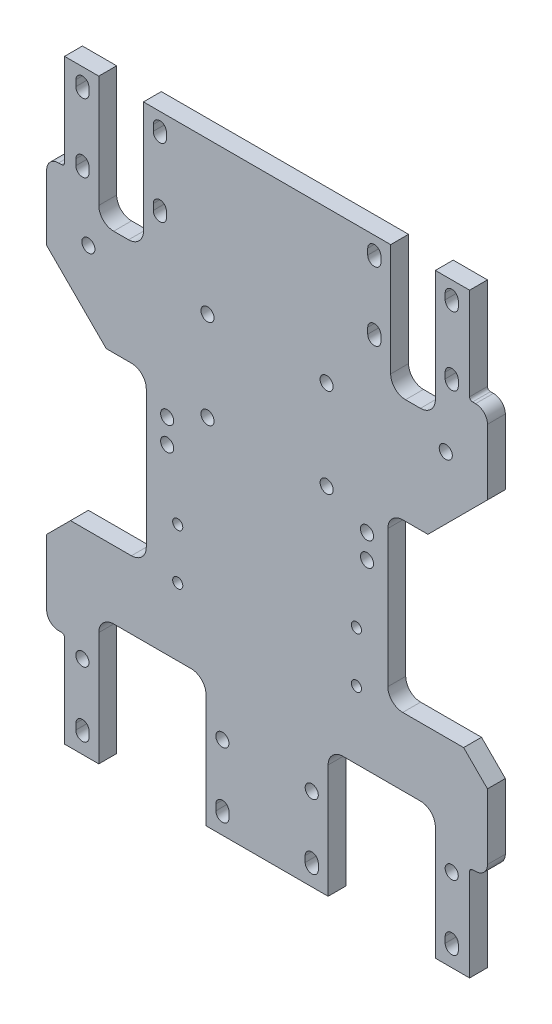
from build123d import *

# Parameters (mm, degrees)
SKETCH1_R           = 2.2
SKETCH1_R_2         = 1.7
BOSS_EXTRUDE1_DEPTH = 6


with BuildPart() as part:
    # Sketch1 → Boss-Extrude1 (new body)
    with BuildSketch(Plane.XY.offset(3)):
        with BuildLine():
            Line((40.555136163, -29), (40.555136163, 17))
            ThreePointArc((40.555136163, 17), (42.019602257, 20.535533906), (45.555136163, 22))
            Line((45.555136163, 22), (54, 22))
            Line((54, 22), (74, 42))
            Line((74, 42), (74, 64))
            ThreePointArc((74, 64), (72.828427125, 66.828427125), (70, 68))
            Line((70, 68), (69, 68))
            ThreePointArc((69, 68), (68.292893219, 68.292893219), (68, 69))
            Line((68, 69), (68, 100))
            Line((68, 100), (56.5, 100))
            Line((56.5, 100), (56.5, 62.4))
            ThreePointArc((56.5, 62.4), (55.035533906, 58.864466094), (51.5, 57.4))
            Line((51.5, 57.4), (46.5, 57.4))
            ThreePointArc((46.5, 57.4), (42.964466094, 58.864466094), (41.5, 62.4))
            Line((41.5, 62.4), (41.5, 100))
            Line((41.5, 100), (-41.5, 100))
            Line((-41.5, 100), (-41.5, 62.4))
            ThreePointArc((-41.5, 62.4), (-42.964466094, 58.864466094), (-46.5, 57.4))
            Line((-46.5, 57.4), (-51.5, 57.4))
            ThreePointArc((-51.5, 57.4), (-55.035533906, 58.864466094), (-56.5, 62.4))
            Line((-56.5, 62.4), (-56.5, 100))
            Line((-56.5, 100), (-68, 100))
            Line((-68, 100), (-68, 69))
            ThreePointArc((-68, 69), (-68.292893219, 68.292893219), (-69, 68))
            Line((-69, 68), (-70, 68))
            ThreePointArc((-70, 68), (-72.828427125, 66.828427125), (-74, 64))
            Line((-74, 64), (-74, 42))
            Line((-74, 42), (-54, 22))
            Line((-54, 22), (-45.555136163, 22))
            ThreePointArc((-45.555136163, 22), (-42.019602257, 20.535533906), (-40.555136163, 17))
            Line((-40.555136163, 17), (-40.555136163, -29))
            ThreePointArc((-40.555136163, -29), (-42.019602257, -32.535533906), (-45.555136163, -34))
            Line((-45.555136163, -34), (-66, -34))
            Line((-66, -34), (-74, -42))
            Line((-74, -42), (-74, -64))
            ThreePointArc((-74, -64), (-72.828427125, -66.828427125), (-70, -68))
            Line((-70, -68), (-69, -68))
            ThreePointArc((-69, -68), (-68.292893219, -68.292893219), (-68, -69))
            Line((-68, -69), (-68, -100))
            Line((-68, -100), (-56.5, -100))
            Line((-56.5, -100), (-56.5, -61.8))
            ThreePointArc((-56.5, -61.8), (-55.035533906, -58.264466094), (-51.5, -56.8))
            Line((-51.5, -56.8), (-25.5, -56.8))
            ThreePointArc((-25.5, -56.8), (-21.964466094, -58.264466094), (-20.5, -61.8))
            Line((-20.5, -61.8), (-20.5, -100))
            Line((-20.5, -100), (20.5, -100))
            Line((20.5, -100), (20.5, -61.8))
            ThreePointArc((20.5, -61.8), (21.964466094, -58.264466094), (25.5, -56.8))
            Line((25.5, -56.8), (51.5, -56.8))
            ThreePointArc((51.5, -56.8), (55.035533906, -58.264466094), (56.5, -61.8))
            Line((56.5, -61.8), (56.5, -100))
            Line((56.5, -100), (68, -100))
            Line((68, -100), (68, -69))
            ThreePointArc((68, -69), (68.292893219, -68.292893219), (69, -68))
            Line((69, -68), (70, -68))
            ThreePointArc((70, -68), (72.828427125, -66.828427125), (74, -64))
            Line((74, -64), (74, -42))
            Line((74, -42), (66, -34))
            Line((66, -34), (45.555136163, -34))
            ThreePointArc((45.555136163, -34), (42.019602257, -32.535533906), (40.555136163, -29))
        make_face()
        with Locations(Location((-20, 19, 0), (0, 0, 180))):
            Circle(SKETCH1_R, mode=Mode.SUBTRACT)
        with Locations(Location((60, 49, 0), (0, 0, 180))):
            Circle(SKETCH1_R, mode=Mode.SUBTRACT)
        with Locations(Location((20, 49, 0), (0, 0, 180))):
            Circle(SKETCH1_R, mode=Mode.SUBTRACT)
        with Locations(Location((33.555136163, 4.3, 0), (0, 0, 180))):
            Circle(SKETCH1_R, mode=Mode.SUBTRACT)
        with Locations(Location((30, -17.1, 0), (0, 0, 180))):
            Circle(SKETCH1_R_2, mode=Mode.SUBTRACT)
        with Locations(Location((-33.555136163, 12.3, 0), (0, 0, 180))):
            Circle(SKETCH1_R, mode=Mode.SUBTRACT)
        with Locations(Location((-30, -34.1, 0), (0, 0, 180))):
            Circle(SKETCH1_R_2, mode=Mode.SUBTRACT)
        with Locations(Location((62, -72.2, 0), (0, 0, 180))):
            Circle(SKETCH1_R, mode=Mode.SUBTRACT)
        with Locations(Location((-62, -72.2, 0), (0, 0, 180))):
            Circle(SKETCH1_R, mode=Mode.SUBTRACT)
        with Locations(Location((-15, -72.2, 0), (0, 0, 180))):
            Circle(SKETCH1_R, mode=Mode.SUBTRACT)
        with Locations(Location((15, -72.2, 0), (0, 0, 180))):
            Circle(SKETCH1_R, mode=Mode.SUBTRACT)
        with Locations(Location((-30, -17.1, 0), (0, 0, 180))):
            Circle(SKETCH1_R_2, mode=Mode.SUBTRACT)
        with Locations(Location((-33.555136163, 4.3, 0), (0, 0, 180))):
            Circle(SKETCH1_R, mode=Mode.SUBTRACT)
        with Locations(Location((30, -34.1, 0), (0, 0, 180))):
            Circle(SKETCH1_R_2, mode=Mode.SUBTRACT)
        with Locations(Location((33.555136163, 12.3, 0), (0, 0, 180))):
            Circle(SKETCH1_R, mode=Mode.SUBTRACT)
        with Locations(Location((20, 19, 0), (0, 0, 180))):
            Circle(SKETCH1_R, mode=Mode.SUBTRACT)
        with Locations(Location((-20, 49, 0), (0, 0, 180))):
            Circle(SKETCH1_R, mode=Mode.SUBTRACT)
        with Locations(Location((-60, 49, 0), (0, 0, 180))):
            Circle(SKETCH1_R, mode=Mode.SUBTRACT)
        with BuildLine():
            Line((38.2, 95.1), (38.2, 93.1))
            ThreePointArc((38.2, 93.1), (36, 90.9), (33.8, 93.1))
            Line((33.8, 93.1), (33.8, 95.1))
            ThreePointArc((33.8, 95.1), (36, 97.3), (38.2, 95.1))
        make_face(mode=Mode.SUBTRACT)
        with BuildLine():
            Line((64.2, 72.1), (64.2, 70.1))
            ThreePointArc((64.2, 70.1), (62, 67.9), (59.8, 70.1))
            Line((59.8, 70.1), (59.8, 72.1))
            ThreePointArc((59.8, 72.1), (62, 74.3), (64.2, 72.1))
        make_face(mode=Mode.SUBTRACT)
        with BuildLine():
            Line((-38.2, 70.1), (-38.2, 72.1))
            ThreePointArc((-38.2, 72.1), (-36, 74.3), (-33.8, 72.1))
            Line((-33.8, 72.1), (-33.8, 70.1))
            ThreePointArc((-33.8, 70.1), (-36, 67.9), (-38.2, 70.1))
        make_face(mode=Mode.SUBTRACT)
        with BuildLine():
            Line((-64.2, 93.1), (-64.2, 95.1))
            ThreePointArc((-64.2, 95.1), (-62, 97.3), (-59.8, 95.1))
            Line((-59.8, 95.1), (-59.8, 93.1))
            ThreePointArc((-59.8, 93.1), (-62, 90.9), (-64.2, 93.1))
        make_face(mode=Mode.SUBTRACT)
        with BuildLine():
            Line((12.8, -94), (12.8, -92))
            ThreePointArc((12.8, -92), (15, -89.8), (17.2, -92))
            Line((17.2, -92), (17.2, -94))
            ThreePointArc((17.2, -94), (15, -96.2), (12.8, -94))
        make_face(mode=Mode.SUBTRACT)
        with BuildLine():
            Line((-12.8, -92), (-12.8, -94))
            ThreePointArc((-12.8, -94), (-15, -96.2), (-17.2, -94))
            Line((-17.2, -94), (-17.2, -92))
            ThreePointArc((-17.2, -92), (-15, -89.8), (-12.8, -92))
        make_face(mode=Mode.SUBTRACT)
        with BuildLine():
            Line((-59.8, -92), (-59.8, -94))
            ThreePointArc((-59.8, -94), (-62, -96.2), (-64.2, -94))
            Line((-64.2, -94), (-64.2, -92))
            ThreePointArc((-64.2, -92), (-62, -89.8), (-59.8, -92))
        make_face(mode=Mode.SUBTRACT)
        with BuildLine():
            Line((59.8, -94), (59.8, -92))
            ThreePointArc((59.8, -92), (62, -89.8), (64.2, -92))
            Line((64.2, -92), (64.2, -94))
            ThreePointArc((64.2, -94), (62, -96.2), (59.8, -94))
        make_face(mode=Mode.SUBTRACT)
        with BuildLine():
            Line((-64.2, 70.1), (-64.2, 72.1))
            ThreePointArc((-64.2, 72.1), (-62, 74.3), (-59.8, 72.1))
            Line((-59.8, 72.1), (-59.8, 70.1))
            ThreePointArc((-59.8, 70.1), (-62, 67.9), (-64.2, 70.1))
        make_face(mode=Mode.SUBTRACT)
        with BuildLine():
            Line((-38.2, 93.1), (-38.2, 95.1))
            ThreePointArc((-38.2, 95.1), (-36, 97.3), (-33.8, 95.1))
            Line((-33.8, 95.1), (-33.8, 93.1))
            ThreePointArc((-33.8, 93.1), (-36, 90.9), (-38.2, 93.1))
        make_face(mode=Mode.SUBTRACT)
        with BuildLine():
            Line((64.2, 95.1), (64.2, 93.1))
            ThreePointArc((64.2, 93.1), (62, 90.9), (59.8, 93.1))
            Line((59.8, 93.1), (59.8, 95.1))
            ThreePointArc((59.8, 95.1), (62, 97.3), (64.2, 95.1))
        make_face(mode=Mode.SUBTRACT)
        with BuildLine():
            Line((38.2, 72.1), (38.2, 70.1))
            ThreePointArc((38.2, 70.1), (36, 67.9), (33.8, 70.1))
            Line((33.8, 70.1), (33.8, 72.1))
            ThreePointArc((33.8, 72.1), (36, 74.3), (38.2, 72.1))
        make_face(mode=Mode.SUBTRACT)
    extrude(amount=-BOSS_EXTRUDE1_DEPTH)


solid = part.part
